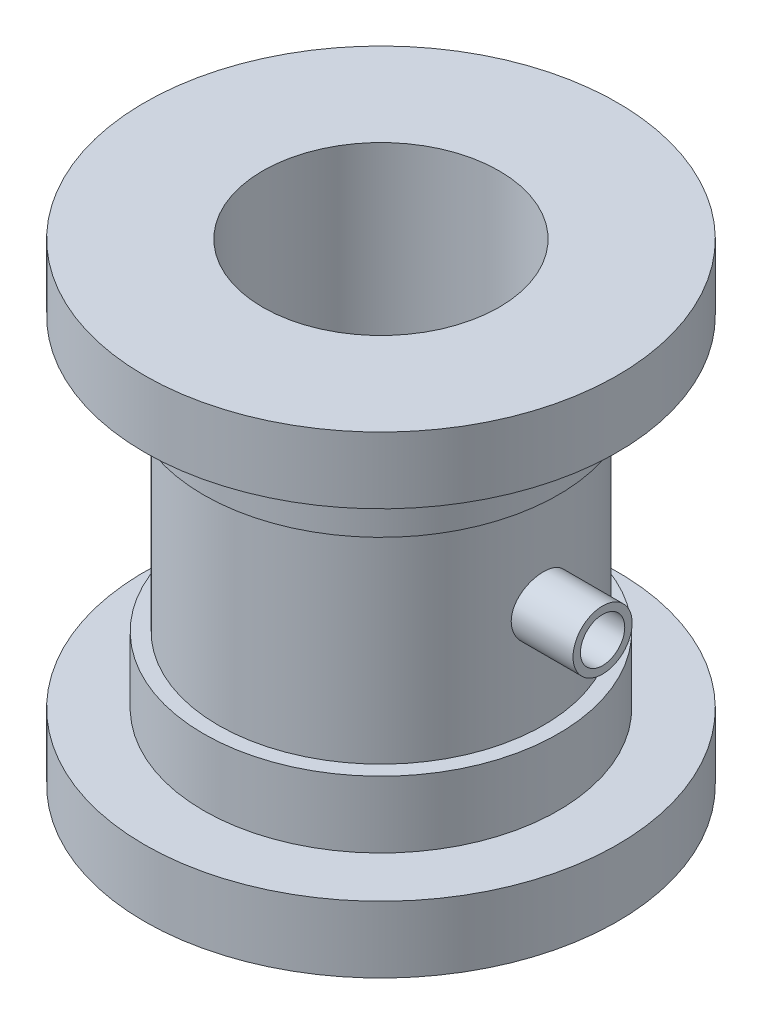
from build123d import *
from build123d.topology import SkipClean

# Parameters (mm, degrees)
SKETCH1_R             = 22
BOSS_EXTRUDE1_DEPTH   = 28
SKETCH2_R             = 24
BOSS_EXTRUDE5_DEPTH   = 9
SKETCH3_R             = 32
BOSS_EXTRUDE6_DEPTH   = 9
F_8_0MM_DOWEL_HOLE1_D = 32
BOSS_EXTRUDE8_DEPTH   = 30
CUT_EXTRUDE1_DEPTH    = 79.383671851
SKETCH9_R             = 3
CUT_EXTRUDE2_DEPTH    = 84.570329718


with BuildPart() as part:
    # Sketch1 → Boss-Extrude1 (new body)
    with BuildSketch(Plane(origin=(0, 0, 0), x_dir=(1, 0, 0), z_dir=(0, 1, 0))):
        with Locations(Location((0, 0, 0), (0, 0, 270))):
            Circle(SKETCH1_R)
    extrude(amount=BOSS_EXTRUDE1_DEPTH)

    # Sketch2 → Boss-Extrude5 (add)
    with BuildSketch(Plane(origin=(0, 28, 0), x_dir=(1, 0, 0), z_dir=(0, 1, 0))):
        with Locations(Location((0, 0, 0), (0, 0, 270))):
            Circle(SKETCH2_R)
    extrude(amount=BOSS_EXTRUDE5_DEPTH)

    # Sketch3 → Boss-Extrude6 (add)
    with BuildSketch(Plane(origin=(0, 37, 0), x_dir=(1, 0, 0), z_dir=(0, 1, 0))):
        with Locations(Location((0, 0, 0), (0, 0, 270))):
            Circle(SKETCH3_R)
    extrude(amount=BOSS_EXTRUDE6_DEPTH)

    # Mirror1: part across plane


with BuildPart() as part_1:
    add(part.part)
    add(part.part.mirror(Plane(origin=(0, 14, 0), x_dir=(0, 0, 1), z_dir=(0, -1, 0))))

    # Ø8.0mm Dowel Hole1 (through all)
    with Locations(Plane(origin=(0, -18, 0), x_dir=(-1, 0, 0), z_dir=(0, -1, 0))):
        with Locations((0, 0)):
            Hole(F_8_0MM_DOWEL_HOLE1_D / 2)

    # Sketch7 → Boss-Extrude8 (add)
    with BuildSketch(Plane(origin=(0, 0, 0), x_dir=(0, 0, -1), z_dir=(1, 0, 0))):
        with BuildLine():
            ThreePointArc((0, 18), (-4, 14), (0, 10))
            Line((0, 10), (0, 18))
        make_face()
        with BuildLine():
            Line((0, 18), (0, 10))
            ThreePointArc((0, 10), (2.828427125, 11.171572875), (4, 14))
            ThreePointArc((4, 14), (2.828427125, 16.828427125), (0, 18))
        make_face()
    extrude(amount=BOSS_EXTRUDE8_DEPTH)

    # Sketch8 → Cut-Extrude1 (cut, through all)
    with BuildSketch(Plane.XZ.offset(18)):
        with BuildLine():
            Line((14.379345194, 7.016725146), (-2.299536677, 7.016725146))
            Line((-2.299536677, 7.016725146), (-2.299536677, -6.73632558))
            Line((-2.299536677, -6.73632558), (14.512819081, -6.73632558))
            ThreePointArc((14.512819081, -6.73632558), (15.999246551, 0.155273303), (14.379345194, 7.016725146))
        make_face()
    extrude(amount=-CUT_EXTRUDE1_DEPTH, mode=Mode.SUBTRACT)

    # Sketch9 → Cut-Extrude2 (cut, through all)
    with SkipClean():  # the faces are left unmerged after this step: merging them gives an invalid solid
        with BuildSketch(Plane(origin=(30, 0, 0), x_dir=(0, 0, -1), z_dir=(1, 0, 0))):
            with Locations((0, 14)):
                Circle(SKETCH9_R)
        extrude(amount=-CUT_EXTRUDE2_DEPTH, mode=Mode.SUBTRACT)


solid = part_1.part
